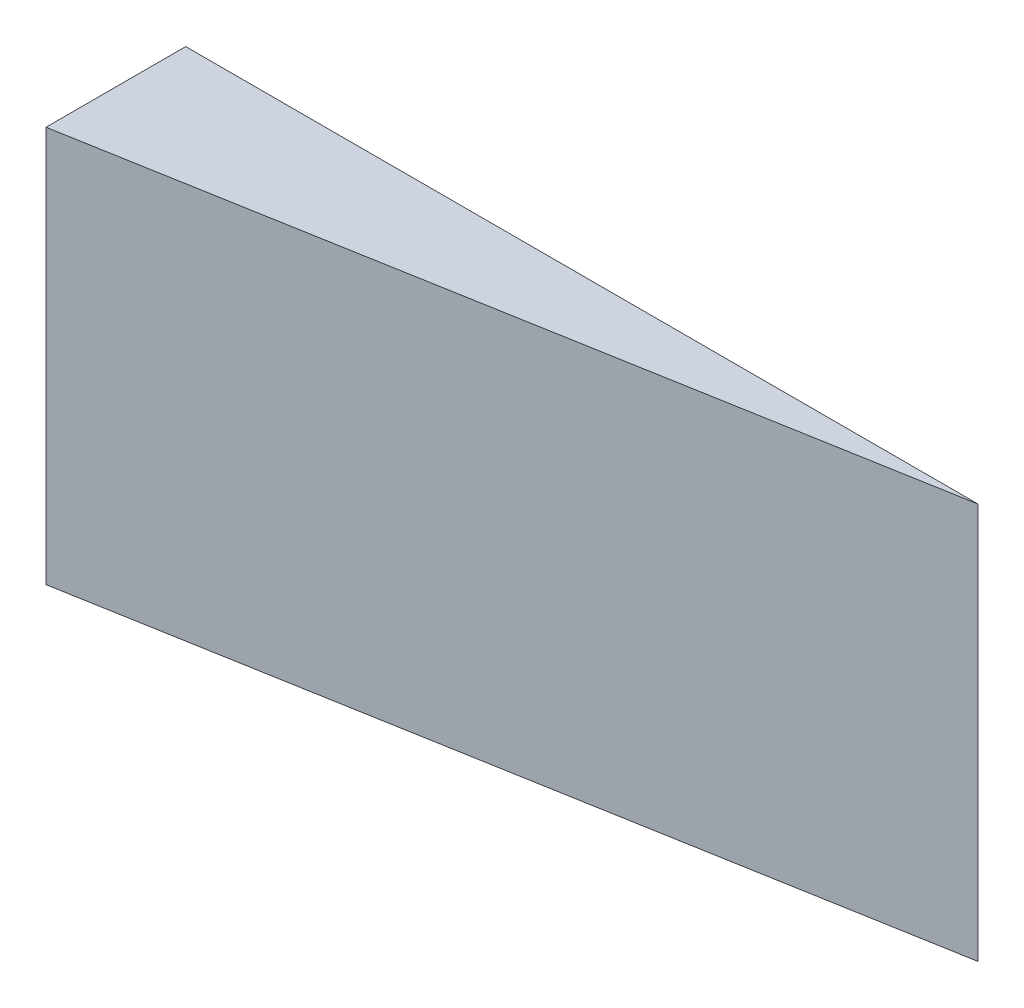
from build123d import *

# Parameters (mm, degrees)
BOSS_EXTRUDE1_DEPTH = 20


with BuildPart() as part:
    # Sketch1 → Boss-Extrude1 (new body)
    with BuildSketch(Plane(origin=(0, 0, 0), x_dir=(1, 0, 0), z_dir=(0, 1, 0))):
        Polygon((0, 0), (40, 0), (0, -7.053079228), align=None)
    extrude(amount=BOSS_EXTRUDE1_DEPTH)


solid = part.part
